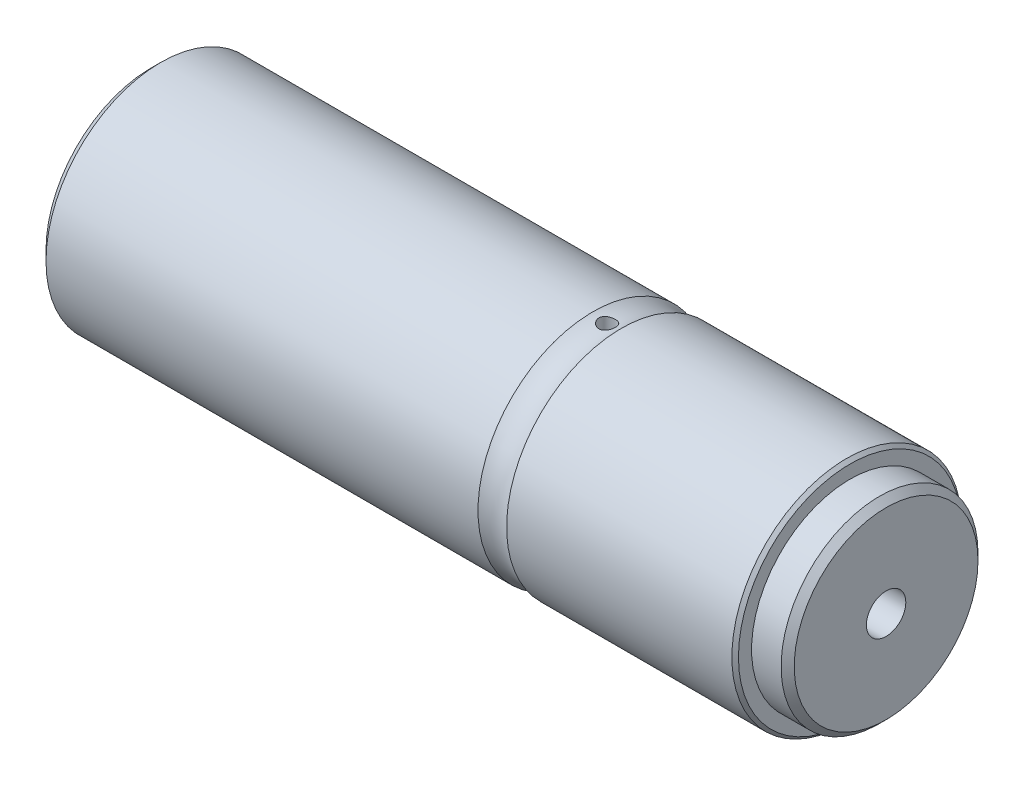
from build123d import *

# Parameters (mm, degrees)
CHAMFER_1_SIZE            = 3
CHAMFER_2_SIZE            = 2
CHAMFER_3_SIZE            = 1
SKETCH_2_R                = 2.5
CUT_EXTRUDE_1_DEPTH       = 50
HOLE_WIZARD_8_0_8_1_D     = 8
HOLE_WIZARD_8_0_8_1_DEPTH = 90
HOLE_WIZARD_8_0_8_1_TIP   = 2.403442476
HOLE_WIZARD_M14_1_D       = 12
HOLE_WIZARD_M14_1_DEPTH   = 45
HOLE_WIZARD_M14_1_TIP     = 3.605163714


with BuildPart() as part:
    # 草图1 → 旋转1 (revolve)
    with BuildSketch(Plane.XY, mode=Mode.PRIVATE) as revolve_1_sk:
        with BuildLine():
            Line((0, 0), (0, 30))
            Line((0, 30), (-11, 30))
            Line((-11, 30), (-11, 35))
            Line((-11, 35), (-80.641101056, 35))
            ThreePointArc((-80.641101056, 35), (-85, 34), (-89.358898944, 35))
            Line((-89.358898944, 35), (-224, 35))
            Line((-224, 35), (-224, 0))
            Line((-224, 0), (0, 0))
        make_face()
    revolve(revolve_1_sk.sketch.rotate(Axis((0, 0, 0), (-1, 0, 0)), 90), axis=Axis((0, 0, 0), (-1, 0, 0)))

    # 倒角1
    chamfer_1_edges = [part.edges().sort_by_distance(p)[0] for p in [
        (-224, 0, 35),
    ]]
    chamfer(chamfer_1_edges, length=CHAMFER_1_SIZE)

    # 倒角2
    chamfer_2_edges = [part.edges().sort_by_distance(p)[0] for p in [
        (0, 0, 30),
    ]]
    chamfer(chamfer_2_edges, length=CHAMFER_2_SIZE)

    # 倒角3
    chamfer_3_edges = [part.edges().sort_by_distance(p)[0] for p in [
        (-11, 0, 35),
    ]]
    chamfer(chamfer_3_edges, length=CHAMFER_3_SIZE)

    # 草图2 → 切除-拉伸1 (cut, symmetric)
    with BuildSketch(Plane(origin=(0, 0, 0), x_dir=(1, 0, 0), z_dir=(0, 1, 0))):
        with Locations(Location((-85, 0, 0), (0, 0, 134.50396252))):
            Circle(SKETCH_2_R)
    extrude(amount=CUT_EXTRUDE_1_DEPTH, both=True, mode=Mode.SUBTRACT)

    # Ø8.0 (8) 直径孔1
    with Locations(Plane(origin=(0, 0, 0), x_dir=(0, 0, 1), z_dir=(1, 0, 0))):
        with Locations((0, 0)):
            Hole(HOLE_WIZARD_8_0_8_1_D / 2, depth=HOLE_WIZARD_8_0_8_1_DEPTH)
            with Locations((0, 0, -(HOLE_WIZARD_8_0_8_1_DEPTH + HOLE_WIZARD_8_0_8_1_TIP / 2))):  # 118° drill point
                Cone(0, HOLE_WIZARD_8_0_8_1_D / 2, HOLE_WIZARD_8_0_8_1_TIP, mode=Mode.SUBTRACT)

    # M14 螺纹孔1
    with Locations(Plane(origin=(0, 0, 0), x_dir=(0, 0, 1), z_dir=(1, 0, 0))):
        with Locations((0, 0)):
            Hole(HOLE_WIZARD_M14_1_D / 2, depth=HOLE_WIZARD_M14_1_DEPTH)
            with Locations((0, 0, -(HOLE_WIZARD_M14_1_DEPTH + HOLE_WIZARD_M14_1_TIP / 2))):  # 118° drill point
                Cone(0, HOLE_WIZARD_M14_1_D / 2, HOLE_WIZARD_M14_1_TIP, mode=Mode.SUBTRACT)


solid = part.part
